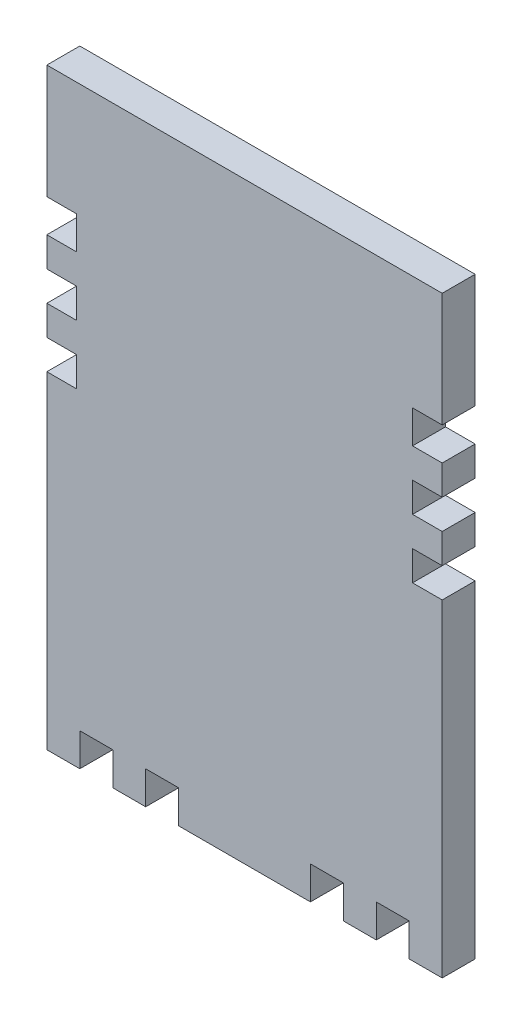
from build123d import *

# Parameters (mm, degrees)
BOSS_EXTRU_1_DEPTH = 5


with BuildPart() as part:
    # Esquisse2 → Boss.-Extru.1 (new body)
    with BuildSketch(Plane.XY):
        Polygon((58.152327252, 164.581889926), (58.152327252, 74.581889926), (68.152327252, 74.581889926), (68.152327252, 79.581889926), (73.152327252, 79.581889926), (73.152327252, 74.581889926), (78.152327252, 74.581889926), (78.152327252, 79.581889926), (83.152327252, 79.581889926), (83.152327252, 74.581889926), (88.152327252, 74.581889926), (88.152327252, 124.272441926), (83.652327252, 124.272441926), (83.652327252, 128.772441926), (88.152327252, 128.772441926), (88.152327252, 133.272441926), (83.652327252, 133.272441926), (83.652327252, 137.772441926), (88.152327252, 137.772441926), (88.152327252, 142.272441926), (83.652327252, 142.272441926), (83.652327252, 147.272441926), (88.152327252, 147.272441926), (88.152327252, 164.581889926), align=None)
        Polygon((32.652327252, 124.272441926), (28.152327252, 124.272441926), (28.152327252, 74.581889926), (33.152327252, 74.581889926), (33.152327252, 79.581889926), (38.152327252, 79.581889926), (38.152327252, 74.581889926), (43.152327252, 74.581889926), (43.152327252, 79.581889926), (48.152327252, 79.581889926), (48.152327252, 74.581889926), (58.152327252, 74.581889926), (58.152327252, 164.581889926), (28.152327252, 164.581889926), (28.152327252, 147.272441926), (32.652327252, 147.272441926), (32.652327252, 142.272441926), (28.152327252, 142.272441926), (28.152327252, 137.772441926), (32.652327252, 137.772441926), (32.652327252, 133.272441926), (28.152327252, 133.272441926), (28.152327252, 128.772441926), (32.652327252, 128.772441926), align=None)
    extrude(amount=BOSS_EXTRU_1_DEPTH)


solid = part.part
